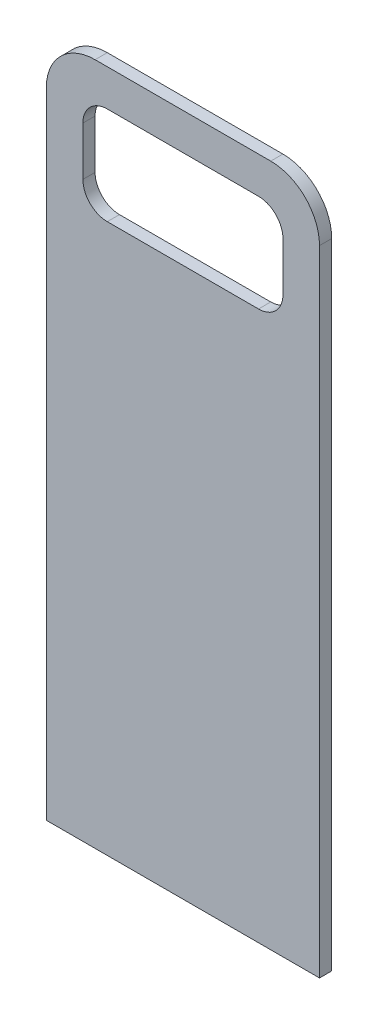
from build123d import *

# Parameters (mm, degrees)
SKETCH1_W           = 112
SKETCH1_H           = 280
SKETCH1_W_2         = 82
SKETCH1_H_2         = 40
BOSS_EXTRUDE1_DEPTH = 5
FILLET1_R           = 20
FILLET2_R           = 10


with BuildPart() as part:
    # Sketch1 → Boss-Extrude1 (new body)
    with BuildSketch(Plane.XY):
        with Locations((-56, 140)):
            Rectangle(SKETCH1_W, SKETCH1_H)
        with Locations((-56, 245)):
            Rectangle(SKETCH1_W_2, SKETCH1_H_2, mode=Mode.SUBTRACT)
    extrude(amount=BOSS_EXTRUDE1_DEPTH)

    # Fillet1
    fillet1_edges = [part.edges().sort_by_distance(p)[0] for p in [
        (-112, 280, 2.5),
        (0, 280, 2.5),
    ]]
    fillet(fillet1_edges, radius=FILLET1_R)

    # Fillet2
    fillet2_edges = [part.edges().sort_by_distance(p)[0] for p in [
        (-15, 225, 2.5),
        (-15, 265, 2.5),
        (-97, 265, 2.5),
        (-97, 225, 2.5),
    ]]
    fillet(fillet2_edges, radius=FILLET2_R)


solid = part.part
